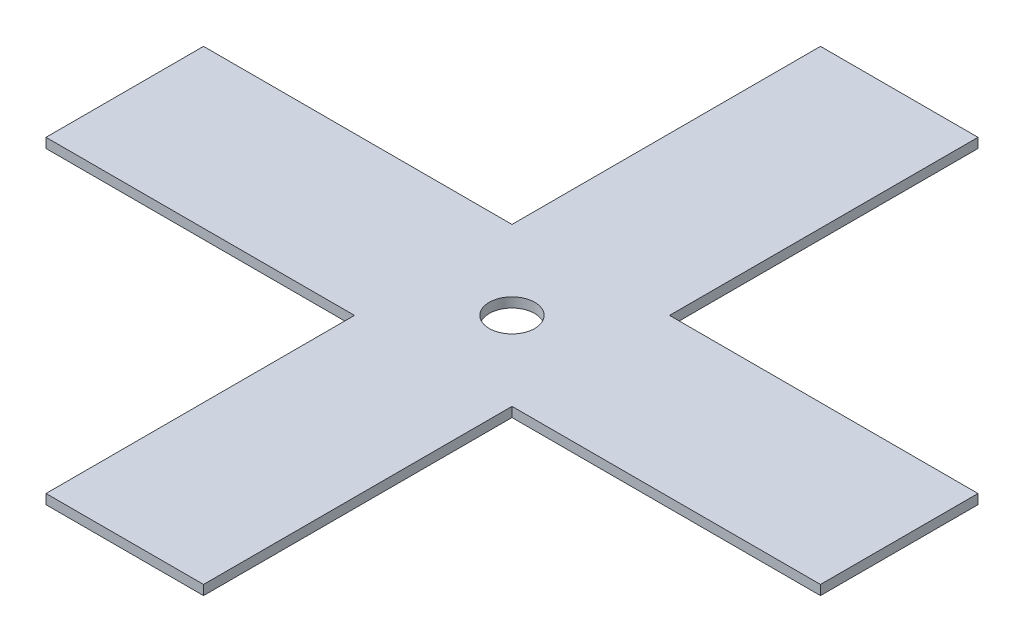
from build123d import *

# Parameters (mm, degrees)
SKETCH1_R           = 2.75
BOSS_EXTRUDE1_DEPTH = 1.175


with BuildPart() as part:
    # Sketch1 → Boss-Extrude1 (new body)
    with BuildSketch(Plane(origin=(0, 0, 0), x_dir=(1, 0, 0), z_dir=(0, 1, 0))):
        Polygon((0, 0), (0, 37.3), (-37.3, 37.3), (-37.3, 56.35), (0, 56.35), (0, 93.65), (19.05, 93.65), (19.05, 56.35), (56.35, 56.35), (56.35, 37.3), (19.05, 37.3), (19.05, 0), align=None)
        with Locations(Location((9.525, 46.825, 0), (0, 0, 270))):
            Circle(SKETCH1_R, mode=Mode.SUBTRACT)
    extrude(amount=BOSS_EXTRUDE1_DEPTH)


solid = part.part
